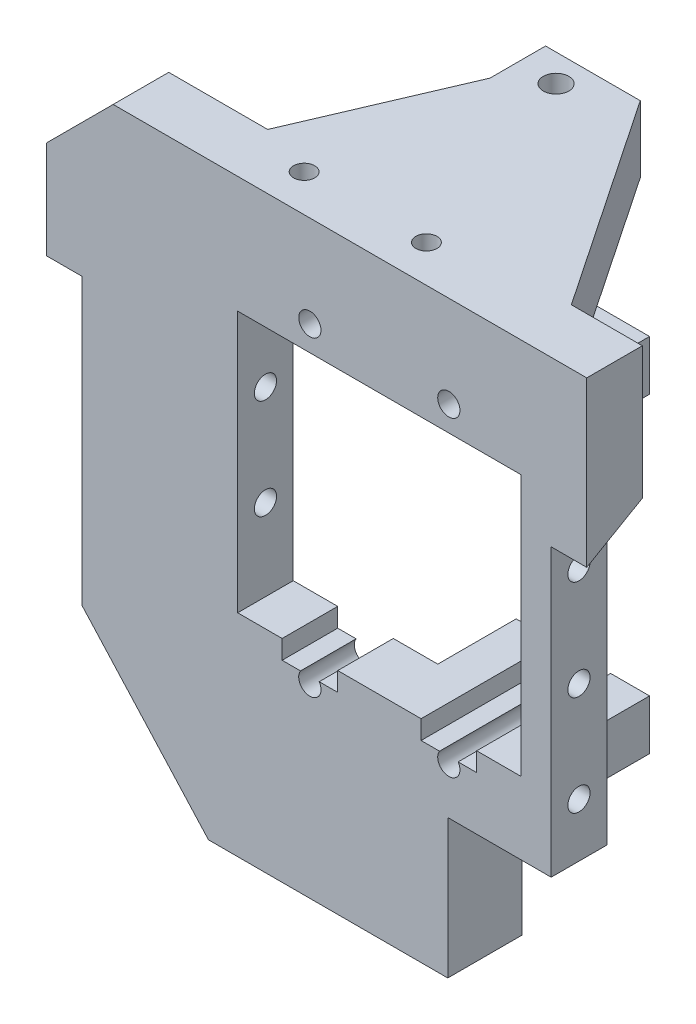
from build123d import *
from build123d.topology import SkipClean

# Parameters (mm, degrees)
SKETCH_1_R          = 1.000029699
SKETCH_1_R_2        = 1.000000092
EXTRUDE_1_DEPTH     = 5
EXTRUDE_START       = 7.05
SKETCH_2_W          = 12
SKETCH_2_H          = 4.5
SKETCH_2_R          = 1.000000092
EXTRUDE_2_DEPTH     = 7.05
SKETCH_3_W          = 21.526040124
SKETCH_3_H          = 12.5
EXTRUDE_3_DEPTH     = 1.68
SKETCH_4_R          = 0.95
CUT_EXTRUDE_1_DEPTH = 5
SKETCH_5_R          = 1.149999977
EXTRUDE_4_DEPTH     = 6
CUT_EXTRUDE_START   = -5
SKETCH_6_R          = 0.95
CUT_EXTRUDE_2_DEPTH = 5
SKETCH_7_R          = 1.000001095
SKETCH_7_R_2        = 0.999998737
CUT_EXTRUDE_3_DEPTH = 100
SKETCH_9_R          = 1
CUT_EXTRUDE_4_DEPTH = 3
CUT_EXTRUDE_START_2 = -3
SKETCH_10_R         = 1
CUT_EXTRUDE_5_DEPTH = 3
CUT_EXTRUDE_6_DEPTH = 3.2
CUT_EXTRUDE_7_DEPTH = 3.2


with BuildPart() as part:
    # 草图1 → 凸台-拉伸1 (new body)
    with BuildSketch(Plane.XY):
        Polygon((21.440408464, 11.835070794), (24.640408464, 11.835070794), (24.640408464, 26.596532095), (-17.959592209, 26.596532095), (-23.959592393, 20.596531911), (-23.959592393, 11.805155949), (-20.759591536, 11.805155949), (-20.759591536, -13.834684697), (-9.38563166, -26.403467905), (12.140408464, -26.403467905), (12.140408464, -13.903467905), (21.440408464, -13.903467905), align=None)
        with Locations((-0.265302528, 18.346532095)):
            Circle(SKETCH_1_R, mode=Mode.SUBTRACT)
        with Locations((12.234697472, 18.346532095)):
            Circle(SKETCH_1_R_2, mode=Mode.SUBTRACT)
        with BuildLine():
            ThreePointArc((11.399532521, -9.103467905), (12.234697472, -10.653468153), (13.069862423, -9.103467905))
            Line((13.069862423, -9.103467905), (14.740408464, -9.103467905))
            Line((14.740408464, -9.103467905), (14.740408464, -7.403467905))
            Line((14.740408464, -7.403467905), (18.740408464, -7.403467905))
            Line((18.740408464, -7.403467905), (18.740408464, 16.096532095))
            Line((18.740408464, 16.096532095), (-6.759591536, 16.096532095))
            Line((-6.759591536, 16.096532095), (-6.759591536, -7.403467905))
            Line((-6.759591536, -7.403467905), (-2.759591536, -7.403467905))
            Line((-2.759591536, -7.403467905), (-2.759591536, -9.103467905))
            Line((-2.759591536, -9.103467905), (-1.105259185, -9.103467905))
            ThreePointArc((-1.105259185, -9.103467905), (-0.265302528, -10.657473475), (0.574654129, -9.103467905))
            Line((0.574654129, -9.103467905), (2.240408464, -9.103467905))
            Line((2.240408464, -9.103467905), (2.240408464, -7.403467905))
            Line((2.240408464, -7.403467905), (9.740408464, -7.403467905))
            Line((9.740408464, -7.403467905), (9.740408464, -9.103467905))
            Line((9.740408464, -9.103467905), (11.399532521, -9.103467905))
        make_face(mode=Mode.SUBTRACT)
    extrude(amount=EXTRUDE_1_DEPTH)

    # 草图2 → 凸台-拉伸2 (add)
    # profile 1 of 2: a face of its own
    with SkipClean():  # the faces are left unmerged after this step: merging them gives an invalid solid
        with BuildSketch(Plane(origin=(0, 0, 0), x_dir=(-1, 0, 0), z_dir=(0, 0, -1)).offset(EXTRUDE_START)):
            with BuildLine():
                Line((-18.240408464, -7.403467905), (-18.240408464, -11.903467905))
                Line((-18.240408464, -11.903467905), (-6.240408464, -11.903467905))
                Line((-6.240408464, -11.903467905), (-6.240408464, -7.403467905))
                Line((-6.240408464, -7.403467905), (-9.740408464, -7.403467905))
                Line((-9.740408464, -7.403467905), (-9.740408464, -9.103467905))
                Line((-9.740408464, -9.103467905), (-11.399532521, -9.103467905))
                ThreePointArc((-11.399532521, -9.103467905), (-12.234697472, -10.653468153), (-13.069862423, -9.103467905))
                Line((-13.069862423, -9.103467905), (-14.740408464, -9.103467905))
                Line((-14.740408464, -9.103467905), (-14.740408464, -7.403467905))
                Line((-14.740408464, -7.403467905), (-18.240408464, -7.403467905))
            make_face()
        # profile 2 of 2: a face of its own
        with BuildSketch(Plane(origin=(0, 0, 0), x_dir=(-1, 0, 0), z_dir=(0, 0, -1)).offset(EXTRUDE_START)):
            with Locations((-12.240408464, 18.346532095)):
                Rectangle(SKETCH_2_W, SKETCH_2_H)
            with Locations((-12.234697472, 18.346532095)):
                Circle(SKETCH_2_R, mode=Mode.SUBTRACT)
        extrude(amount=-EXTRUDE_2_DEPTH)

    # 草图3 → 凸台-拉伸3 (add)
    with SkipClean():  # the faces are left unmerged after this step: merging them gives an invalid solid
        with BuildSketch(Plane(origin=(0, 0, 0), x_dir=(-1, 0, 0), z_dir=(0, 0, -1))):
            with Locations((-1.377388402, -20.153467905)):
                Rectangle(SKETCH_3_W, SKETCH_3_H)
        extrude(amount=EXTRUDE_3_DEPTH)

    # 草图4 → 切除-拉伸1 (cut)
    with SkipClean():  # the faces are left unmerged after this step: merging them gives an invalid solid
        with BuildSketch(Plane.XZ.offset(26.403467905)):
            with Locations((6.877388402, 1.66)):
                Circle(SKETCH_4_R)
            with Locations((-4.122611598, 1.66)):
                Circle(SKETCH_4_R)
        extrude(amount=-CUT_EXTRUDE_1_DEPTH, mode=Mode.SUBTRACT)

    # 草图5 → 凸台-拉伸4 (add)
    with SkipClean():  # the faces are left unmerged after this step: merging them gives an invalid solid
        with BuildSketch(Plane(origin=(0, 20.596532095, 0), x_dir=(1, 0, 0), z_dir=(0, 1, 0))):
            Polygon((18.256022121, 0), (5.456022884, 18.999999285), (-3.061941956, 18.999999285), (-3.061941956, 13.999999523), (-9.061942433, 0), align=None)
            with Locations(Location((0.344281244, 16.535050638, 0), (0, 0, 270))):
                Circle(SKETCH_5_R, mode=Mode.SUBTRACT)
        extrude(amount=EXTRUDE_4_DEPTH)

    # 草图6 → 切除-拉伸2 (cut)
    with SkipClean():  # the faces are left unmerged after this step: merging them gives an invalid solid
        with BuildSketch(Plane(origin=(0, 26.596532095, 0), x_dir=(1, 0, 0), z_dir=(0, 1, 0)).offset(CUT_EXTRUDE_START)):
            with Locations((-4.122611598, -1.66)):
                Circle(SKETCH_6_R)
            with Locations((6.877388402, -1.66)):
                Circle(SKETCH_6_R)
        extrude(amount=CUT_EXTRUDE_2_DEPTH, mode=Mode.SUBTRACT)

    # 草图7 → 切除-拉伸3 (cut)
    with SkipClean():  # the faces are left unmerged after this step: merging them gives an invalid solid
        with BuildSketch(Plane(origin=(21.440408464, 0, 0), x_dir=(0, 0, -1), z_dir=(1, 0, 0))):
            with Locations(Location((-2.5, 8.935070794, 0), (0, 0, 90))):
                Circle(SKETCH_7_R)
            with Locations(Location((-2.5, -0.06643386, 0), (0, 0, 90))):
                Circle(SKETCH_7_R_2)
        extrude(amount=-CUT_EXTRUDE_3_DEPTH, mode=Mode.SUBTRACT)

    # 草图9 → 切除-拉伸4 (cut)
    with SkipClean():  # the faces are left unmerged after this step: merging them gives an invalid solid
        with BuildSketch(Plane(origin=(21.440408464, 0, 0), x_dir=(0, 0, -1), z_dir=(1, 0, 0))):
            with Locations(Location((-2.5, -9.064929206, 0), (0, 0, 90))):
                Circle(SKETCH_9_R)
        extrude(amount=-CUT_EXTRUDE_4_DEPTH, mode=Mode.SUBTRACT)

    # 草图10 → 切除-拉伸5 (cut)
    with SkipClean():  # the faces are left unmerged after this step: merging them gives an invalid solid
        with BuildSketch(Plane.ZY.offset(20.759591536).offset(CUT_EXTRUDE_START_2)):
            with Locations(Location((2.5, -9.064929206, 0), (0, 0, 90))):
                Circle(SKETCH_10_R)
        extrude(amount=CUT_EXTRUDE_5_DEPTH, mode=Mode.SUBTRACT)

    # 草图11 → 切除-拉伸6 (cut)
    with SkipClean():  # the faces are left unmerged after this step: merging them gives an invalid solid
        with BuildSketch(Plane(origin=(24.640408464, 0, 0), x_dir=(0, 0, -1), z_dir=(1, 0, 0))):
            Polygon((-5, 11.835070794), (0, 14.72182214), (0, 11.835070794), align=None)
        extrude(amount=-CUT_EXTRUDE_6_DEPTH, mode=Mode.SUBTRACT)

    # 草图12 → 切除-拉伸7 (cut)
    with SkipClean():  # the faces are left unmerged after this step: merging them gives an invalid solid
        with BuildSketch(Plane.ZY.offset(23.959592393)):
            Polygon((5, 11.805155949), (0, 11.805155949), (0, 14.691907295), align=None)
        extrude(amount=-CUT_EXTRUDE_7_DEPTH, mode=Mode.SUBTRACT)


solid = part.part
